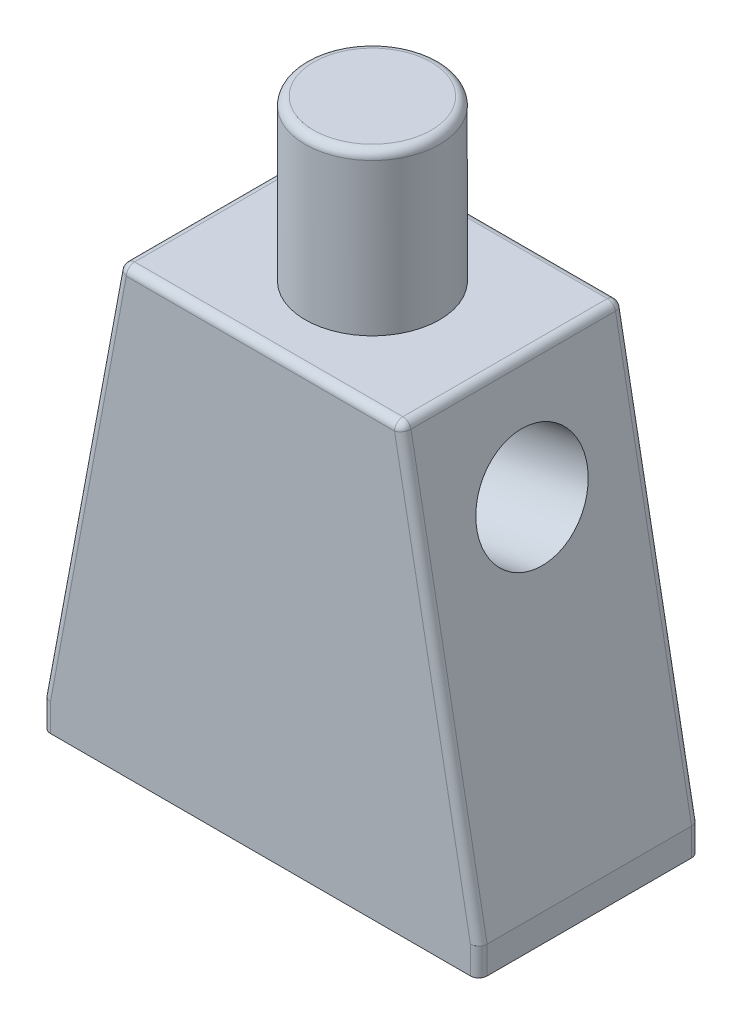
from build123d import *

# Parameters (mm, degrees)
BOSS_EXTRUDE1_DEPTH = 203.2
FILLET1_R           = 7.62
SKETCH2_R           = 61.722
BOSS_EXTRUDE2_DEPTH = 147.1422
FILLET2_R           = 7.62
SKETCH4_R           = 61.722
CUT_EXTRUDE2_DEPTH  = 121.7422
SKETCH6_R           = 50.8
CUT_EXTRUDE3_DEPTH  = 101.6
SKETCH5_R           = 50.8
CUT_EXTRUDE4_DEPTH  = 101.6
BOSS_EXTRUDE3_START = 25.4
SKETCH7_W           = 401.32
SKETCH7_H           = 203.2
SKETCH7_R           = 61.722
BOSS_EXTRUDE3_DEPTH = 25.4
FILLET3_R           = 7.62


with BuildPart() as part:
    # Sketch1 → Boss-Extrude1 (new body)
    with BuildSketch(Plane.XY):
        Polygon((129.54, 113.962405063), (-129.54, 113.962405063), (-200.66, -267.037594937), (200.66, -267.037594937), align=None)
    extrude(amount=BOSS_EXTRUDE1_DEPTH)

    # Fillet1
    fillet1_edges = [part.edges().sort_by_distance(p)[0] for p in [
        (-165.1, -76.537594937, 203.2),
        (165.1, -76.537594937, 203.2),
        (-165.1, -76.537594937, 0),
        (0, 113.962405063, 0),
        (165.1, -76.537594937, 0),
        (0, 113.962405063, 203.2),
        (-129.54, 113.962405063, 101.6),
        (129.54, 113.962405063, 101.6),
    ]]
    fillet(fillet1_edges, radius=FILLET1_R)

    # Sketch2 → Boss-Extrude2 (add)
    with BuildSketch(Plane(origin=(0, 113.962405063, 0), x_dir=(1, 0, 0), z_dir=(0, 1, 0))):
        with Locations((1.290779411, -101.591800302)):
            Circle(SKETCH2_R)
    extrude(amount=BOSS_EXTRUDE2_DEPTH)

    # Fillet2
    fillet2_edges = [part.edges().sort_by_distance(p)[0] for p in [
        (-60.431220589, 261.104605063, 101.591800302),
    ]]
    fillet(fillet2_edges, radius=FILLET2_R)

    # Sketch4 → Cut-Extrude2 (cut)
    with BuildSketch(Plane(origin=(0, -267.037594937, 0), x_dir=(-1, 0, 0), z_dir=(0, -1, 0))):
        with Locations(Location((100.33, -101.6, 0), (0, 0, 90))):
            Circle(SKETCH4_R)
        with Locations(Location((-100.33, -101.6, 0), (0, 0, 90))):
            Circle(SKETCH4_R)
    extrude(amount=-CUT_EXTRUDE2_DEPTH, mode=Mode.SUBTRACT)

    # Sketch6 → Cut-Extrude3 (cut)
    with BuildSketch(Plane(origin=(145.73492962, 27.203853529, 0), x_dir=(0, 0, -1), z_dir=(0.9830202487654599, 0.18349711310288594, 0))):
        with Locations(Location((-101.6, -12.052084845, 0), (0, 0, 90))):
            Circle(SKETCH6_R)
    extrude(amount=-CUT_EXTRUDE3_DEPTH, mode=Mode.SUBTRACT)

    # Sketch5 → Cut-Extrude4 (cut)
    with BuildSketch(Plane(origin=(-145.73492962, 27.203853529, 0), x_dir=(0, 0, 1), z_dir=(-0.98302024876546, 0.18349711310288583, 0))):
        with Locations(Location((101.6, -12.052084845, 0), (0, 0, 270))):
            Circle(SKETCH5_R)
    extrude(amount=-CUT_EXTRUDE4_DEPTH, mode=Mode.SUBTRACT)

    # Sketch7 → Boss-Extrude3 (add)
    with BuildSketch(Plane.XZ.offset(267.037594937).offset(BOSS_EXTRUDE3_START)):
        with Locations((0, 101.6)):
            Rectangle(SKETCH7_W, SKETCH7_H)
        with Locations(Location((-100.33, 101.6, 0), (0, 0, 270))):
            Circle(SKETCH7_R, mode=Mode.SUBTRACT)
        with Locations(Location((100.33, 101.6, 0), (0, 0, 270))):
            Circle(SKETCH7_R, mode=Mode.SUBTRACT)
    extrude(amount=-BOSS_EXTRUDE3_DEPTH)

    # Fillet3
    fillet3_edges = [part.edges().sort_by_distance(p)[0] for p in [
        (-200.66, -279.737594937, 0),
        (200.66, -279.737594937, 203.2),
        (200.66, -279.737594937, 0),
        (-200.66, -279.737594937, 203.2),
    ]]
    fillet(fillet3_edges, radius=FILLET3_R)


solid = part.part
